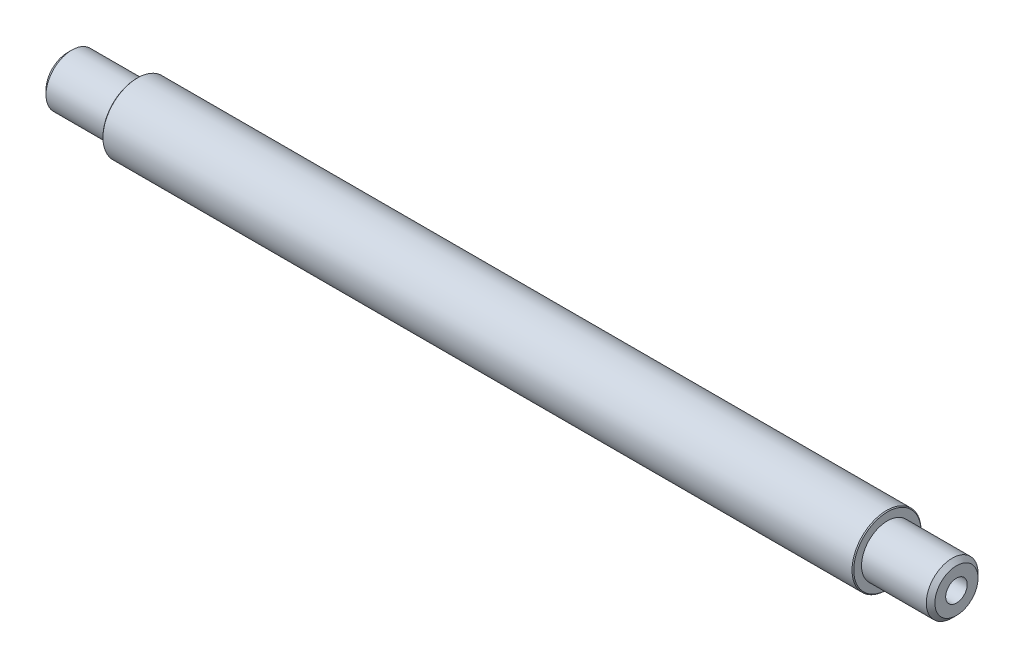
from build123d import *

# Parameters (mm, degrees)
CHAMFER_1_SIZE = 0.5
CHAMFER_2_SIZE = 0.1


with BuildPart() as part:
    # ｽｹｯﾁ1 → 回転1 (revolve)
    with BuildSketch(Plane.XY, mode=Mode.PRIVATE) as revolve_1_sk:
        Polygon((43.5, 4), (-43.5, 4), (-43.5, 3), (-51.5, 3), (-51.5, 0), (51.5, 0), (51.5, 3), (43.5, 3), align=None)
    revolve(revolve_1_sk.sketch.rotate(Axis((-61.290700214, 0, 0), (1, 0, 0)), 90), axis=Axis((-61.290700214, 0, 0), (1, 0, 0)))

    # 面取り1
    chamfer_1_edges = [part.edges().sort_by_distance(p)[0] for p in [
        (-51.5, 0, -3),
        (51.5, 0, -3),
    ]]
    chamfer(chamfer_1_edges, length=CHAMFER_1_SIZE)

    # 面取り2
    chamfer_2_edges = [part.edges().sort_by_distance(p)[0] for p in [
        (-43.5, 0, -4),
        (43.5, 0, -4),
    ]]
    chamfer(chamfer_2_edges, length=CHAMFER_2_SIZE)

    # ｽｹｯﾁ3 → M3 ねじ穴1 (revolve, cut)
    with BuildSketch(Plane(origin=(51.5, 0, 0), x_dir=(0, 0, -1), z_dir=(0, 1, 0))):
        Polygon((0, 0), (0, 9.251075774), (1.25, 8.5), (1.25, 0), align=None)
    hole_wizard_m3_1 = revolve(axis=Axis((57.85, 0, 0), (-1, 0, 0)), mode=Mode.SUBTRACT)

    # ﾐﾗｰ1: M3 ねじ穴1 across plane
    add(hole_wizard_m3_1.mirror(Plane(origin=(0, 0, 0), x_dir=(0, 0, 1), z_dir=(1, 0, 0))), mode=Mode.SUBTRACT)


solid = part.part
